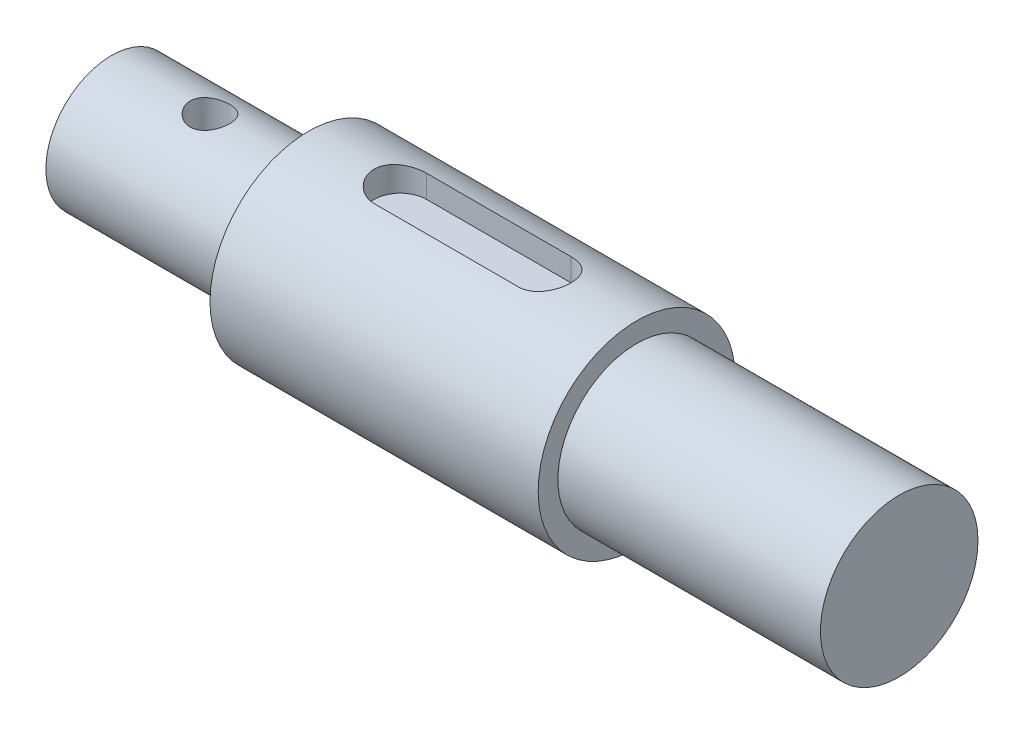
from build123d import *

# Parameters (mm, degrees)
SKETCH_1_R          = 10
EXTRUDE_1_DEPTH     = 30
SKETCH_2_R          = 15
EXTRUDE_2_DEPTH     = 50
SKETCH_3_R          = 12
EXTRUDE_3_DEPTH     = 40
CUT_EXTRUDE_1_DEPTH = 4
SKETCH_5_R          = 3
CUT_EXTRUDE_2_DEPTH = 121


with BuildPart() as part:
    # 草图1 → 凸台-拉伸1 (new body)
    with BuildSketch(Plane(origin=(0, 0, 0), x_dir=(0, 0, -1), z_dir=(1, 0, 0))):
        Circle(SKETCH_1_R)
    extrude(amount=EXTRUDE_1_DEPTH)

    # 草图2 → 凸台-拉伸2 (add)
    with BuildSketch(Plane(origin=(30, 0, 0), x_dir=(0, 0, -1), z_dir=(1, 0, 0))):
        Circle(SKETCH_2_R)
    extrude(amount=EXTRUDE_2_DEPTH)

    # 草图3 → 凸台-拉伸3 (add)
    with BuildSketch(Plane(origin=(80, 0, 0), x_dir=(0, 0, -1), z_dir=(1, 0, 0))):
        Circle(SKETCH_3_R)
    extrude(amount=EXTRUDE_3_DEPTH)

    # 草图4 → 切除-拉伸1 (cut)
    with BuildSketch(Plane(origin=(0, 15, 0), x_dir=(1, 0, 0), z_dir=(0, 1, 0))):
        with BuildLine():
            Line((44, 4), (66, 4))
            ThreePointArc((66, 4), (70, 0), (66, -4))
            Line((66, -4), (44, -4))
            ThreePointArc((44, -4), (40, 0), (44, 4))
        make_face()
    extrude(amount=-CUT_EXTRUDE_1_DEPTH, mode=Mode.SUBTRACT)

    # 草图5 → 切除-拉伸2 (cut, symmetric)
    with BuildSketch(Plane(origin=(0, 0, 0), x_dir=(1, 0, 0), z_dir=(0, 1, 0))):
        with Locations(Location((15, 0, 0), (0, 0, 270))):
            Circle(SKETCH_5_R)
    extrude(amount=CUT_EXTRUDE_2_DEPTH, both=True, mode=Mode.SUBTRACT)


solid = part.part
